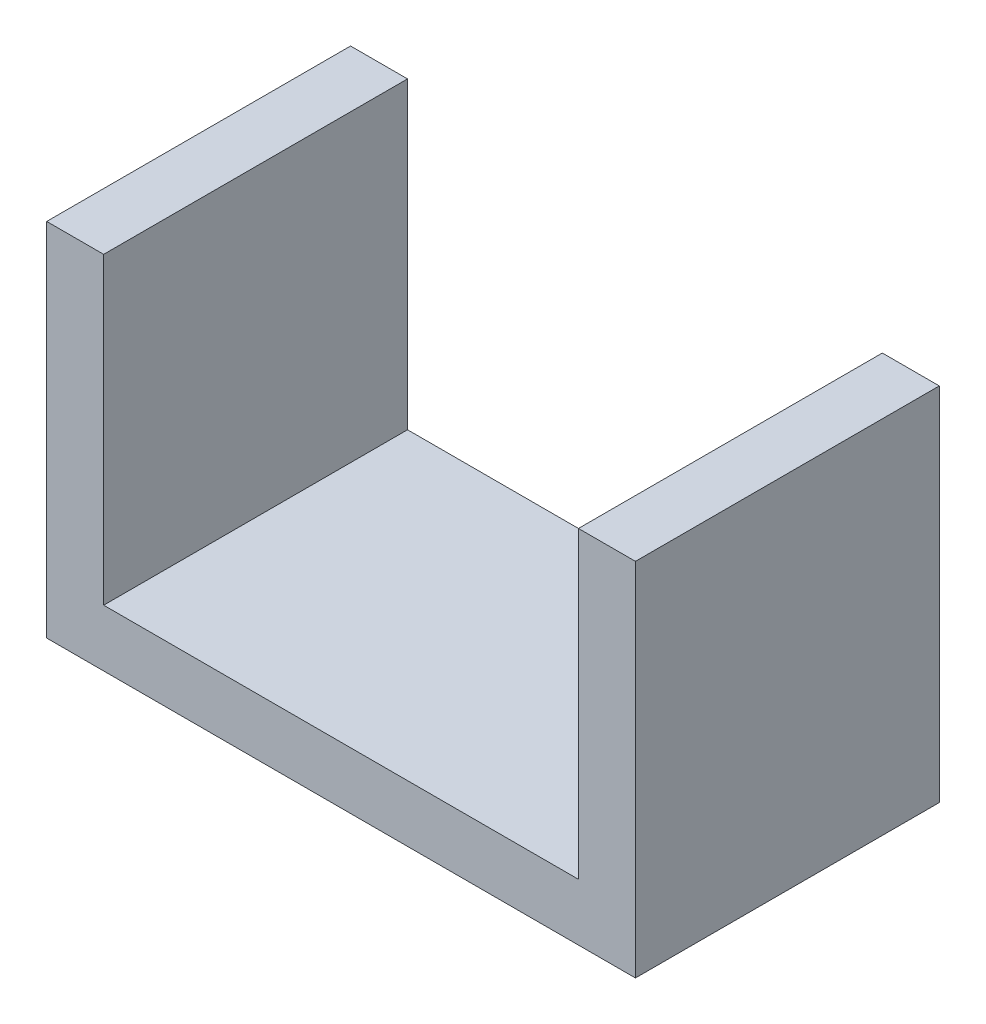
from build123d import *

# Parameters (mm, degrees)
EXTRUDE_1_DEPTH = 8


with BuildPart() as part:
    # 스케치1 → 보스-돌출1 (new body)
    with BuildSketch(Plane.XY):
        Polygon((-9.578824164, 5.567751479), (-9.578824164, -3.932248521), (5.921175836, -3.932248521), (5.921175836, 5.567751479), (4.421175836, 5.567751479), (4.421175836, -2.432248521), (-8.078824164, -2.432248521), (-8.078824164, 5.567751479), align=None)
    extrude(amount=EXTRUDE_1_DEPTH)


solid = part.part
